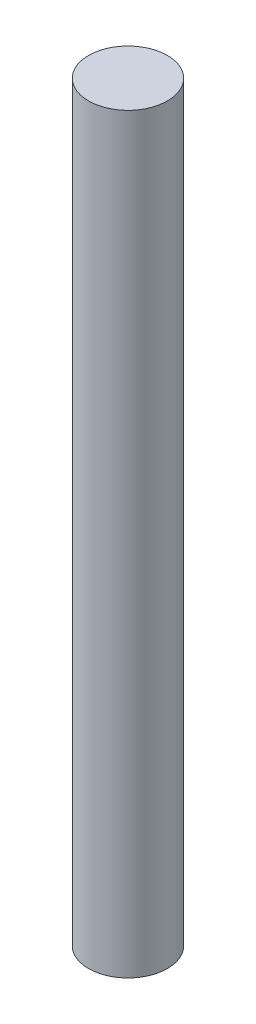
from build123d import *

# Parameters (mm, degrees)
IZIM1_R                     = 7.5
Y_KSEKLIK_EKSTR_ZYON1_DEPTH = 143


with BuildPart() as part:
    # Çizim1 → Yükseklik-Ekstrüzyon1 (new body)
    with BuildSketch(Plane(origin=(0, 0, 0), x_dir=(1, 0, 0), z_dir=(0, 1, 0))):
        with Locations(Location((0, 0, 0), (0, 0, 270))):
            Circle(IZIM1_R)
    extrude(amount=Y_KSEKLIK_EKSTR_ZYON1_DEPTH)


solid = part.part
